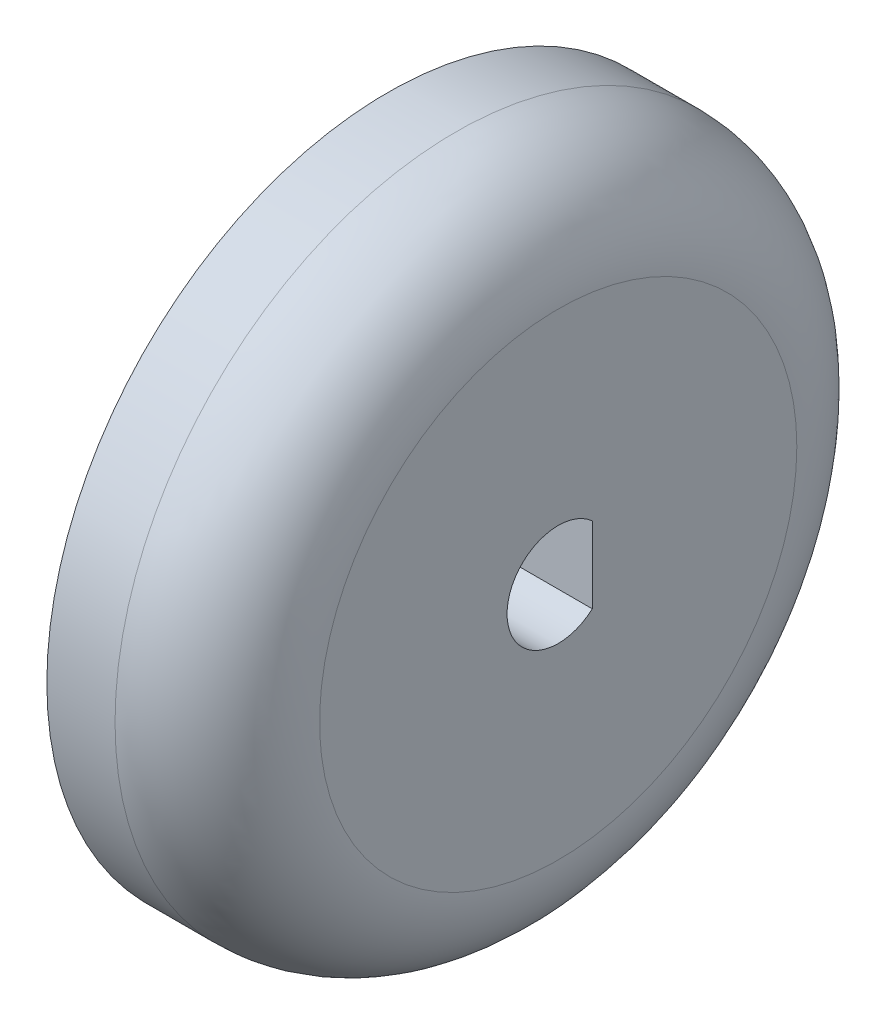
from build123d import *

# Parameters (mm, degrees)
SKETCH1_R           = 10
BOSS_EXTRUDE1_DEPTH = 10
CUT_EXTRUDE1_DEPTH  = 18.320508076
FILLET1_R           = 3


with BuildPart() as part:
    # Sketch1 → Boss-Extrude1 (new body)
    with BuildSketch(Plane(origin=(0, 0, 0), x_dir=(0, -1, 0), z_dir=(1, 0, 0))):
        with Locations(Location((0, 0, 0), (0, 0, 90))):
            Circle(SKETCH1_R)
    extrude(amount=BOSS_EXTRUDE1_DEPTH)

    # Sketch2 → Cut-Extrude1 (cut, through all)
    with BuildSketch(Plane(origin=(10, 0, 0), x_dir=(0, -1, 0), z_dir=(1, 0, 0))):
        with BuildLine():
            Line((-1.118033989, 1), (1.118033989, 1))
            ThreePointArc((1.118033989, 1), (0, -1.5), (-1.118033989, 1))
        make_face()
    extrude(amount=-CUT_EXTRUDE1_DEPTH, mode=Mode.SUBTRACT)

    # Fillet1
    fillet1_edges = [part.edges().sort_by_distance(p)[0] for p in [
        (0, 0, 10),
        (10, 0, 10),
    ]]
    fillet(fillet1_edges, radius=FILLET1_R)

    # SurfaceCut1
    split(bisect_by=Plane.ZY.offset(-5), keep=Keep.BOTTOM)


solid = part.part
